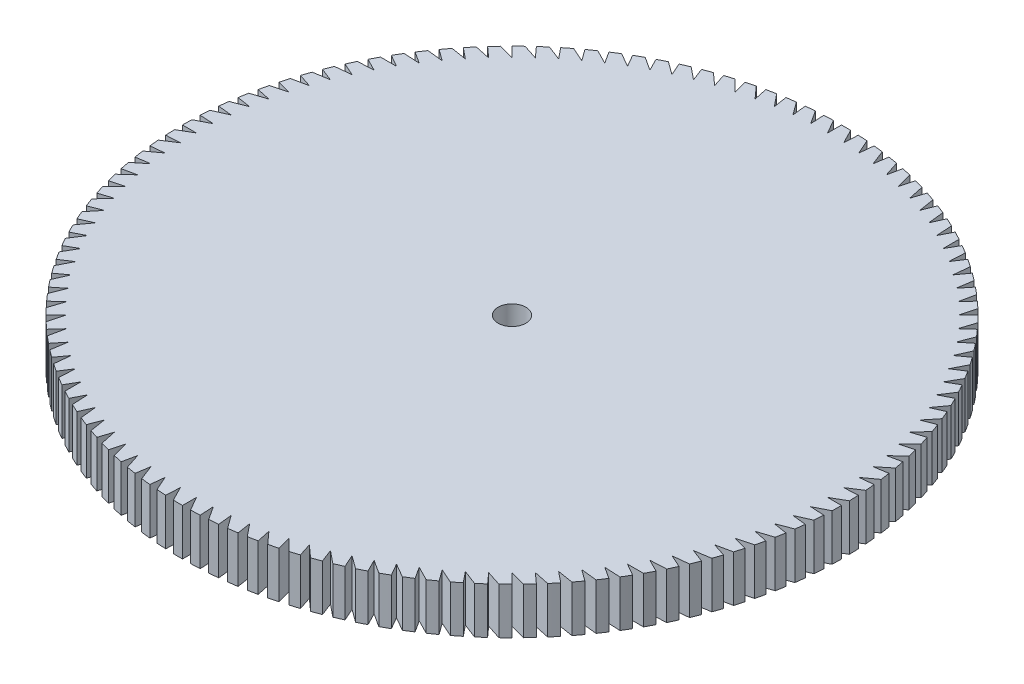
from build123d import *

# Parameters (mm, degrees)
SKETCH_1_R          = 71
EXTRUDE_1_DEPTH     = 10
SKETCH_2_R          = 3
CUT_EXTRUDE_1_DEPTH = 10
CUT_EXTRUDE_2_DEPTH = 101.905896755


with BuildPart() as part:
    # 草图1 → 凸台-拉伸1 (new body)
    with BuildSketch(Plane(origin=(0, 0, 0), x_dir=(1, 0, 0), z_dir=(0, 1, 0))):
        with Locations(Location((0, 0, 0), (0, 0, 270))):
            Circle(SKETCH_1_R)
    extrude(amount=EXTRUDE_1_DEPTH)

    # 草图2 → 切除-拉伸1 (cut)
    with BuildSketch(Plane(origin=(0, 10, 0), x_dir=(1, 0, 0), z_dir=(0, 1, 0))):
        with Locations(Location((0, 0, 0), (0, 0, 270))):
            Circle(SKETCH_2_R)
    extrude(amount=-CUT_EXTRUDE_1_DEPTH, mode=Mode.SUBTRACT)

    # 草图3 → 切除-拉伸2 (cut, through all)
    with BuildSketch(Plane(origin=(0, 10, 0), x_dir=(1, 0, 0), z_dir=(0, 1, 0))):
        with BuildLine():
            Line((0, -71), (0, -68))
            Line((0, -68), (1.720020356, -70.979162646))
            ThreePointArc((1.720020356, -70.979162646), (0.860073285, -70.99479047), (0, -71))
        make_face()
        with BuildLine():
            Line((-3.558845025, -67.906808363), (-1.997099223, -70.971907081))
            ThreePointArc((-1.997099223, -70.971907081), (-2.856685663, -70.942507335), (-3.715852893, -70.902696968))
            Line((-3.715852893, -70.902696968), (-3.558845025, -67.906808363))
        make_face()
        with BuildLine():
            Line((-7.107935502, -67.627488885), (-5.708744891, -70.770122451))
            ThreePointArc((-5.708744891, -70.770122451), (-6.565614635, -70.695775719), (-7.421520892, -70.611054571))
            Line((-7.421520892, -70.611054571), (-7.107935502, -67.627488885))
        make_face()
        with BuildLine():
            Line((-10.637543623, -67.16280716), (-9.404743287, -70.374361835))
            ThreePointArc((-9.404743287, -70.374361835), (-10.256547713, -70.255271895), (-11.106847018, -70.125872182))
            Line((-11.106847018, -70.125872182), (-10.637543623, -67.16280716))
        make_face()
        with BuildLine():
            Line((-14.137994976, -66.51403685), (-13.074963934, -69.785709985))
            ThreePointArc((-13.074963934, -69.785709985), (-13.919368306, -69.622203254), (-14.761730048, -69.448479652))
            Line((-14.761730048, -69.448479652), (-14.137994976, -66.51403685))
        make_face()
        with BuildLine():
            Line((-17.599695067, -65.682956188), (-16.709347015, -69.005780355))
            ThreePointArc((-16.709347015, -69.005780355), (-17.544036879, -68.798304994), (-18.376152202, -68.580733667))
            Line((-18.376152202, -68.580733667), (-17.599695067, -65.682956188))
        make_face()
        with BuildLine():
            Line((-21.013155617, -64.671843108), (-20.297930937, -68.036710677))
            ThreePointArc((-20.297930937, -68.036710677), (-21.120618466, -67.785835361), (-21.940206601, -67.525012657))
            Line((-21.940206601, -67.525012657), (-21.013155617, -64.671843108))
        make_face()
        with BuildLine():
            Line((-24.369020569, -63.483469002), (-23.830879641, -66.881157104))
            ThreePointArc((-23.830879641, -66.881157104), (-24.639309905, -66.587569466), (-25.444124418, -66.284210281))
            Line((-25.444124418, -66.284210281), (-24.369020569, -63.483469002))
        make_face()
        with BuildLine():
            Line((-27.658091729, -62.12109112), (-27.29850956, -65.542286928))
            ThreePointArc((-27.29850956, -65.542286928), (-28.090466709, -65.206791671), (-28.878301658, -64.861727493))
            Line((-28.878301658, -64.861727493), (-27.658091729, -62.12109112))
        make_face()
        with BuildLine():
            Line((-30.871353982, -60.588443645), (-30.691316162, -64.0237699))
            ThreePointArc((-30.691316162, -64.0237699), (-31.464629497, -63.647286593), (-32.233325482, -63.261463217))
            Line((-32.233325482, -63.261463217), (-30.871353982, -60.588443645))
        make_face()
        with BuildLine():
            Line((-34, -58.889727457), (-34, -62.329768169))
            ThreePointArc((-34, -62.329768169), (-34.752549922, -61.913328726), (-35.5, -61.487803669))
            Line((-35.5, -61.487803669), (-34, -58.889727457))
        make_face()
        with BuildLine():
            Line((-37.035454381, -57.02959862), (-37.215492201, -60.464924876))
            ThreePointArc((-37.215492201, -60.464924876), (-37.945216023, -60.009670729), (-38.669371486, -59.545610324))
            Line((-38.669371486, -59.545610324), (-37.035454381, -57.02959862))
        make_face()
        with BuildLine():
            Line((-39.969397156, -55.013155617), (-40.328979325, -58.434351426))
            ThreePointArc((-40.328979325, -58.434351426), (-41.033876924, -57.941530395), (-41.732752913, -57.440206601))
            Line((-41.732752913, -57.440206601), (-39.969397156, -55.013155617))
        make_face()
        with BuildLine():
            Line((-42.793786591, -52.845925379), (-43.33192752, -56.243613481))
            ThreePointArc((-43.33192752, -56.243613481), (-44.010066822, -55.714576354), (-44.681747765, -55.177363263))
            Line((-44.681747765, -55.177363263), (-42.793786591, -52.845925379))
        make_face()
        with BuildLine():
            Line((-45.500881232, -50.533848132), (-46.216105913, -53.898715701))
            ThreePointArc((-46.216105913, -53.898715701), (-46.865628185, -53.334912532), (-47.508273051, -52.763282609))
            Line((-47.508273051, -52.763282609), (-45.500881232, -50.533848132))
        make_face()
        with BuildLine():
            Line((-48.083261121, -48.083261121), (-48.973609173, -51.406085288))
            ThreePointArc((-48.973609173, -51.406085288), (-49.592734119, -50.809061422), (-50.204581464, -50.204581464))
            Line((-50.204581464, -50.204581464), (-48.083261121, -48.083261121))
        make_face()
        with BuildLine():
            Line((-50.533848132, -45.500881232), (-51.596879174, -48.772554368))
            ThreePointArc((-51.596879174, -48.772554368), (-52.183909816, -48.143946207), (-52.763282609, -47.508273051))
            Line((-52.763282609, -47.508273051), (-50.533848132, -45.500881232))
        make_face()
        with BuildLine():
            Line((-52.845925379, -42.793786591), (-54.078725715, -46.005341266))
            ThreePointArc((-54.078725715, -46.005341266), (-54.632053043, -45.346871781), (-55.177363263, -44.681747765))
            Line((-55.177363263, -44.681747765), (-52.845925379, -42.793786591))
        make_face()
        with BuildLine():
            Line((-55.013155617, -39.969397156), (-56.412346229, -43.112030722))
            ThreePointArc((-56.412346229, -43.112030722), (-56.93045361, -42.425504732), (-57.440206601, -41.732752913))
            Line((-57.440206601, -41.732752913), (-55.013155617, -39.969397156))
        make_face()
        with BuildLine():
            Line((-57.02959862, -37.035454381), (-58.591344422, -40.100553099))
            ThreePointArc((-58.591344422, -40.100553099), (-59.072811761, -39.387852323), (-59.545610324, -38.669371486))
            Line((-59.545610324, -38.669371486), (-57.02959862, -37.035454381))
        make_face()
        with BuildLine():
            Line((-58.889727457, -34), (-60.609747813, -36.979162646))
            ThreePointArc((-60.609747813, -36.979162646), (-61.053255441, -36.242240549), (-61.487803669, -35.5))
            Line((-61.487803669, -35.5), (-58.889727457, -34))
        make_face()
        with BuildLine():
            Line((-60.588443645, -30.871353982), (-62.462024098, -33.75641488))
            ThreePointArc((-62.462024098, -33.75641488), (-62.866356392, -32.997291312), (-63.261463217, -32.233325482))
            Line((-63.261463217, -32.233325482), (-60.588443645, -30.871353982))
        make_face()
        with BuildLine():
            Line((-62.12109112, -27.658091729), (-64.143096317, -30.441143126))
            ThreePointArc((-64.143096317, -30.441143126), (-64.50714503, -29.661898794), (-64.861727493, -28.878301658))
            Line((-64.861727493, -28.878301658), (-62.12109112, -27.658091729))
        make_face()
        with BuildLine():
            Line((-63.483469002, -24.369020569), (-65.648356768, -27.042434315))
            ThreePointArc((-65.648356768, -27.042434315), (-65.971124067, -26.245205073), (-66.284210281, -25.444124418))
            Line((-66.284210281, -25.444124418), (-63.483469002, -24.369020569))
        make_face()
        with BuildLine():
            Line((-64.671843108, -21.013155617), (-66.973679635, -23.569604072))
            ThreePointArc((-66.973679635, -23.569604072), (-67.254280839, -22.756575069), (-67.525012657, -21.940206601))
            Line((-67.525012657, -21.940206601), (-64.671843108, -21.013155617))
        make_face()
        with BuildLine():
            Line((-65.682956188, -17.599695067), (-68.115432302, -20.032171182))
            ThreePointArc((-68.115432302, -20.032171182), (-68.353098301, -19.205570875), (-68.580733667, -18.376152202))
            Line((-68.580733667, -18.376152202), (-65.682956188, -17.599695067))
        make_face()
        with BuildLine():
            Line((-66.51403685, -14.137994976), (-69.070485304, -16.439831503))
            ThreePointArc((-69.070485304, -16.439831503), (-69.264564672, -15.601925546), (-69.448479652, -14.761730048))
            Line((-69.448479652, -14.761730048), (-66.51403685, -14.137994976))
        make_face()
        with BuildLine():
            Line((-67.16280716, -10.637543623), (-69.836220907, -12.802431389))
            ThreePointArc((-69.836220907, -12.802431389), (-69.986181686, -11.955516423), (-70.125872182, -11.106847018))
            Line((-70.125872182, -11.106847018), (-67.16280716, -10.637543623))
        make_face()
        with BuildLine():
            Line((-67.627488885, -7.107935502), (-70.410540282, -9.1299407))
            ThreePointArc((-70.410540282, -9.1299407), (-70.515971441, -8.276338061), (-70.611054571, -7.421520892))
            Line((-70.611054571, -7.421520892), (-67.627488885, -7.107935502))
        make_face()
        with BuildLine():
            Line((-67.906808363, -3.558845025), (-70.791869261, -5.432425478))
            ThreePointArc((-70.791869261, -5.432425478), (-70.85248182, -4.574474832), (-70.902696968, -3.715852893))
            Line((-70.902696968, -3.715852893), (-67.906808363, -3.558845025))
        make_face()
        with BuildLine():
            Line((-68, 0), (-70.979162646, -1.720020356))
            ThreePointArc((-70.979162646, -1.720020356), (-70.99479047, -0.860073285), (-71, 0))
            Line((-71, 0), (-68, 0))
        make_face()
        with BuildLine():
            Line((-67.906808363, 3.558845025), (-70.971907081, 1.997099223))
            ThreePointArc((-70.971907081, 1.997099223), (-70.942507335, 2.856685663), (-70.902696968, 3.715852893))
            Line((-70.902696968, 3.715852893), (-67.906808363, 3.558845025))
        make_face()
        with BuildLine():
            Line((-67.627488885, 7.107935502), (-70.770122451, 5.708744891))
            ThreePointArc((-70.770122451, 5.708744891), (-70.695775719, 6.565614635), (-70.611054571, 7.421520892))
            Line((-70.611054571, 7.421520892), (-67.627488885, 7.107935502))
        make_face()
        with BuildLine():
            Line((-67.16280716, 10.637543623), (-70.374361835, 9.404743287))
            ThreePointArc((-70.374361835, 9.404743287), (-70.255271895, 10.256547713), (-70.125872182, 11.106847018))
            Line((-70.125872182, 11.106847018), (-67.16280716, 10.637543623))
        make_face()
        with BuildLine():
            Line((-66.51403685, 14.137994976), (-69.785709985, 13.074963934))
            ThreePointArc((-69.785709985, 13.074963934), (-69.622203254, 13.919368306), (-69.448479652, 14.761730048))
            Line((-69.448479652, 14.761730048), (-66.51403685, 14.137994976))
        make_face()
        with BuildLine():
            Line((-65.682956188, 17.599695067), (-69.005780355, 16.709347015))
            ThreePointArc((-69.005780355, 16.709347015), (-68.798304994, 17.544036879), (-68.580733667, 18.376152202))
            Line((-68.580733667, 18.376152202), (-65.682956188, 17.599695067))
        make_face()
        with BuildLine():
            Line((-64.671843108, 21.013155617), (-68.036710677, 20.297930937))
            ThreePointArc((-68.036710677, 20.297930937), (-67.785835361, 21.120618466), (-67.525012657, 21.940206601))
            Line((-67.525012657, 21.940206601), (-64.671843108, 21.013155617))
        make_face()
        with BuildLine():
            Line((-63.483469002, 24.369020569), (-66.881157104, 23.830879641))
            ThreePointArc((-66.881157104, 23.830879641), (-66.587569466, 24.639309905), (-66.284210281, 25.444124418))
            Line((-66.284210281, 25.444124418), (-63.483469002, 24.369020569))
        make_face()
        with BuildLine():
            Line((-62.12109112, 27.658091729), (-65.542286928, 27.29850956))
            ThreePointArc((-65.542286928, 27.29850956), (-65.206791671, 28.090466709), (-64.861727493, 28.878301658))
            Line((-64.861727493, 28.878301658), (-62.12109112, 27.658091729))
        make_face()
        with BuildLine():
            Line((-60.588443645, 30.871353982), (-64.0237699, 30.691316162))
            ThreePointArc((-64.0237699, 30.691316162), (-63.647286593, 31.464629497), (-63.261463217, 32.233325482))
            Line((-63.261463217, 32.233325482), (-60.588443645, 30.871353982))
        make_face()
        with BuildLine():
            Line((-58.889727457, 34), (-62.329768169, 34))
            ThreePointArc((-62.329768169, 34), (-61.913328726, 34.752549922), (-61.487803669, 35.5))
            Line((-61.487803669, 35.5), (-58.889727457, 34))
        make_face()
        with BuildLine():
            Line((-57.02959862, 37.035454381), (-60.464924876, 37.215492201))
            ThreePointArc((-60.464924876, 37.215492201), (-60.009670729, 37.945216023), (-59.545610324, 38.669371486))
            Line((-59.545610324, 38.669371486), (-57.02959862, 37.035454381))
        make_face()
        with BuildLine():
            Line((-55.013155617, 39.969397156), (-58.434351426, 40.328979325))
            ThreePointArc((-58.434351426, 40.328979325), (-57.941530395, 41.033876924), (-57.440206601, 41.732752913))
            Line((-57.440206601, 41.732752913), (-55.013155617, 39.969397156))
        make_face()
        with BuildLine():
            Line((-52.845925379, 42.793786591), (-56.243613481, 43.33192752))
            ThreePointArc((-56.243613481, 43.33192752), (-55.714576354, 44.010066822), (-55.177363263, 44.681747765))
            Line((-55.177363263, 44.681747765), (-52.845925379, 42.793786591))
        make_face()
        with BuildLine():
            Line((-50.533848132, 45.500881232), (-53.898715701, 46.216105913))
            ThreePointArc((-53.898715701, 46.216105913), (-53.334912532, 46.865628185), (-52.763282609, 47.508273051))
            Line((-52.763282609, 47.508273051), (-50.533848132, 45.500881232))
        make_face()
        with BuildLine():
            Line((-48.083261121, 48.083261121), (-51.406085288, 48.973609173))
            ThreePointArc((-51.406085288, 48.973609173), (-50.809061422, 49.592734119), (-50.204581464, 50.204581464))
            Line((-50.204581464, 50.204581464), (-48.083261121, 48.083261121))
        make_face()
        with BuildLine():
            Line((-45.500881232, 50.533848132), (-48.772554368, 51.596879174))
            ThreePointArc((-48.772554368, 51.596879174), (-48.143946207, 52.183909816), (-47.508273051, 52.763282609))
            Line((-47.508273051, 52.763282609), (-45.500881232, 50.533848132))
        make_face()
        with BuildLine():
            Line((-42.793786591, 52.845925379), (-46.005341266, 54.078725715))
            ThreePointArc((-46.005341266, 54.078725715), (-45.346871781, 54.632053043), (-44.681747765, 55.177363263))
            Line((-44.681747765, 55.177363263), (-42.793786591, 52.845925379))
        make_face()
        with BuildLine():
            Line((-39.969397156, 55.013155617), (-43.112030722, 56.412346229))
            ThreePointArc((-43.112030722, 56.412346229), (-42.425504732, 56.93045361), (-41.732752913, 57.440206601))
            Line((-41.732752913, 57.440206601), (-39.969397156, 55.013155617))
        make_face()
        with BuildLine():
            Line((-37.035454381, 57.02959862), (-40.100553099, 58.591344422))
            ThreePointArc((-40.100553099, 58.591344422), (-39.387852323, 59.072811761), (-38.669371486, 59.545610324))
            Line((-38.669371486, 59.545610324), (-37.035454381, 57.02959862))
        make_face()
        with BuildLine():
            Line((-34, 58.889727457), (-36.979162646, 60.609747813))
            ThreePointArc((-36.979162646, 60.609747813), (-36.242240549, 61.053255441), (-35.5, 61.487803669))
            Line((-35.5, 61.487803669), (-34, 58.889727457))
        make_face()
        with BuildLine():
            Line((-30.871353982, 60.588443645), (-33.75641488, 62.462024098))
            ThreePointArc((-33.75641488, 62.462024098), (-32.997291312, 62.866356392), (-32.233325482, 63.261463217))
            Line((-32.233325482, 63.261463217), (-30.871353982, 60.588443645))
        make_face()
        with BuildLine():
            Line((-27.658091729, 62.12109112), (-30.441143126, 64.143096317))
            ThreePointArc((-30.441143126, 64.143096317), (-29.661898794, 64.50714503), (-28.878301658, 64.861727493))
            Line((-28.878301658, 64.861727493), (-27.658091729, 62.12109112))
        make_face()
        with BuildLine():
            Line((-24.369020569, 63.483469002), (-27.042434315, 65.648356768))
            ThreePointArc((-27.042434315, 65.648356768), (-26.245205073, 65.971124067), (-25.444124418, 66.284210281))
            Line((-25.444124418, 66.284210281), (-24.369020569, 63.483469002))
        make_face()
        with BuildLine():
            Line((-21.013155617, 64.671843108), (-23.569604072, 66.973679635))
            ThreePointArc((-23.569604072, 66.973679635), (-22.756575069, 67.254280839), (-21.940206601, 67.525012657))
            Line((-21.940206601, 67.525012657), (-21.013155617, 64.671843108))
        make_face()
        with BuildLine():
            Line((-17.599695067, 65.682956188), (-20.032171182, 68.115432302))
            ThreePointArc((-20.032171182, 68.115432302), (-19.205570875, 68.353098301), (-18.376152202, 68.580733667))
            Line((-18.376152202, 68.580733667), (-17.599695067, 65.682956188))
        make_face()
        with BuildLine():
            Line((-14.137994976, 66.51403685), (-16.439831503, 69.070485304))
            ThreePointArc((-16.439831503, 69.070485304), (-15.601925546, 69.264564672), (-14.761730048, 69.448479652))
            Line((-14.761730048, 69.448479652), (-14.137994976, 66.51403685))
        make_face()
        with BuildLine():
            Line((-10.637543623, 67.16280716), (-12.802431389, 69.836220907))
            ThreePointArc((-12.802431389, 69.836220907), (-11.955516423, 69.986181686), (-11.106847018, 70.125872182))
            Line((-11.106847018, 70.125872182), (-10.637543623, 67.16280716))
        make_face()
        with BuildLine():
            Line((-7.107935502, 67.627488885), (-9.1299407, 70.410540282))
            ThreePointArc((-9.1299407, 70.410540282), (-8.276338061, 70.515971441), (-7.421520892, 70.611054571))
            Line((-7.421520892, 70.611054571), (-7.107935502, 67.627488885))
        make_face()
        with BuildLine():
            Line((-3.558845025, 67.906808363), (-5.432425478, 70.791869261))
            ThreePointArc((-5.432425478, 70.791869261), (-4.574474832, 70.85248182), (-3.715852893, 70.902696968))
            Line((-3.715852893, 70.902696968), (-3.558845025, 67.906808363))
        make_face()
        with BuildLine():
            Line((0, 68), (-1.720020356, 70.979162646))
            ThreePointArc((-1.720020356, 70.979162646), (-0.860073285, 70.99479047), (0, 71))
            Line((0, 71), (0, 68))
        make_face()
        with BuildLine():
            Line((3.558845025, 67.906808363), (1.997099223, 70.971907081))
            ThreePointArc((1.997099223, 70.971907081), (2.856685663, 70.942507335), (3.715852893, 70.902696968))
            Line((3.715852893, 70.902696968), (3.558845025, 67.906808363))
        make_face()
        with BuildLine():
            Line((7.107935502, 67.627488885), (5.708744891, 70.770122451))
            ThreePointArc((5.708744891, 70.770122451), (6.565614635, 70.695775719), (7.421520892, 70.611054571))
            Line((7.421520892, 70.611054571), (7.107935502, 67.627488885))
        make_face()
        with BuildLine():
            Line((10.637543623, 67.16280716), (9.404743287, 70.374361835))
            ThreePointArc((9.404743287, 70.374361835), (10.256547713, 70.255271895), (11.106847018, 70.125872182))
            Line((11.106847018, 70.125872182), (10.637543623, 67.16280716))
        make_face()
        with BuildLine():
            Line((14.137994976, 66.51403685), (13.074963934, 69.785709985))
            ThreePointArc((13.074963934, 69.785709985), (13.919368306, 69.622203254), (14.761730048, 69.448479652))
            Line((14.761730048, 69.448479652), (14.137994976, 66.51403685))
        make_face()
        with BuildLine():
            Line((17.599695067, 65.682956188), (16.709347015, 69.005780355))
            ThreePointArc((16.709347015, 69.005780355), (17.544036879, 68.798304994), (18.376152202, 68.580733667))
            Line((18.376152202, 68.580733667), (17.599695067, 65.682956188))
        make_face()
        with BuildLine():
            Line((21.013155617, 64.671843108), (20.297930937, 68.036710677))
            ThreePointArc((20.297930937, 68.036710677), (21.120618466, 67.785835361), (21.940206601, 67.525012657))
            Line((21.940206601, 67.525012657), (21.013155617, 64.671843108))
        make_face()
        with BuildLine():
            Line((24.369020569, 63.483469002), (23.830879641, 66.881157104))
            ThreePointArc((23.830879641, 66.881157104), (24.639309905, 66.587569466), (25.444124418, 66.284210281))
            Line((25.444124418, 66.284210281), (24.369020569, 63.483469002))
        make_face()
        with BuildLine():
            Line((27.658091729, 62.12109112), (27.29850956, 65.542286928))
            ThreePointArc((27.29850956, 65.542286928), (28.090466709, 65.206791671), (28.878301658, 64.861727493))
            Line((28.878301658, 64.861727493), (27.658091729, 62.12109112))
        make_face()
        with BuildLine():
            Line((30.871353982, 60.588443645), (30.691316162, 64.0237699))
            ThreePointArc((30.691316162, 64.0237699), (31.464629497, 63.647286593), (32.233325482, 63.261463217))
            Line((32.233325482, 63.261463217), (30.871353982, 60.588443645))
        make_face()
        with BuildLine():
            Line((34, 58.889727457), (34, 62.329768169))
            ThreePointArc((34, 62.329768169), (34.752549922, 61.913328726), (35.5, 61.487803669))
            Line((35.5, 61.487803669), (34, 58.889727457))
        make_face()
        with BuildLine():
            Line((37.035454381, 57.02959862), (37.215492201, 60.464924876))
            ThreePointArc((37.215492201, 60.464924876), (37.945216023, 60.009670729), (38.669371486, 59.545610324))
            Line((38.669371486, 59.545610324), (37.035454381, 57.02959862))
        make_face()
        with BuildLine():
            Line((39.969397156, 55.013155617), (40.328979325, 58.434351426))
            ThreePointArc((40.328979325, 58.434351426), (41.033876924, 57.941530395), (41.732752913, 57.440206601))
            Line((41.732752913, 57.440206601), (39.969397156, 55.013155617))
        make_face()
        with BuildLine():
            Line((42.793786591, 52.845925379), (43.33192752, 56.243613481))
            ThreePointArc((43.33192752, 56.243613481), (44.010066822, 55.714576354), (44.681747765, 55.177363263))
            Line((44.681747765, 55.177363263), (42.793786591, 52.845925379))
        make_face()
        with BuildLine():
            Line((45.500881232, 50.533848132), (46.216105913, 53.898715701))
            ThreePointArc((46.216105913, 53.898715701), (46.865628185, 53.334912532), (47.508273051, 52.763282609))
            Line((47.508273051, 52.763282609), (45.500881232, 50.533848132))
        make_face()
        with BuildLine():
            Line((48.083261121, 48.083261121), (48.973609173, 51.406085288))
            ThreePointArc((48.973609173, 51.406085288), (49.592734119, 50.809061422), (50.204581464, 50.204581464))
            Line((50.204581464, 50.204581464), (48.083261121, 48.083261121))
        make_face()
        with BuildLine():
            Line((50.533848132, 45.500881232), (51.596879174, 48.772554368))
            ThreePointArc((51.596879174, 48.772554368), (52.183909816, 48.143946207), (52.763282609, 47.508273051))
            Line((52.763282609, 47.508273051), (50.533848132, 45.500881232))
        make_face()
        with BuildLine():
            Line((52.845925379, 42.793786591), (54.078725715, 46.005341266))
            ThreePointArc((54.078725715, 46.005341266), (54.632053043, 45.346871781), (55.177363263, 44.681747765))
            Line((55.177363263, 44.681747765), (52.845925379, 42.793786591))
        make_face()
        with BuildLine():
            Line((55.013155617, 39.969397156), (56.412346229, 43.112030722))
            ThreePointArc((56.412346229, 43.112030722), (56.93045361, 42.425504732), (57.440206601, 41.732752913))
            Line((57.440206601, 41.732752913), (55.013155617, 39.969397156))
        make_face()
        with BuildLine():
            Line((57.02959862, 37.035454381), (58.591344422, 40.100553099))
            ThreePointArc((58.591344422, 40.100553099), (59.072811761, 39.387852323), (59.545610324, 38.669371486))
            Line((59.545610324, 38.669371486), (57.02959862, 37.035454381))
        make_face()
        with BuildLine():
            Line((58.889727457, 34), (60.609747813, 36.979162646))
            ThreePointArc((60.609747813, 36.979162646), (61.053255441, 36.242240549), (61.487803669, 35.5))
            Line((61.487803669, 35.5), (58.889727457, 34))
        make_face()
        with BuildLine():
            Line((60.588443645, 30.871353982), (62.462024098, 33.75641488))
            ThreePointArc((62.462024098, 33.75641488), (62.866356392, 32.997291312), (63.261463217, 32.233325482))
            Line((63.261463217, 32.233325482), (60.588443645, 30.871353982))
        make_face()
        with BuildLine():
            Line((62.12109112, 27.658091729), (64.143096317, 30.441143126))
            ThreePointArc((64.143096317, 30.441143126), (64.50714503, 29.661898794), (64.861727493, 28.878301658))
            Line((64.861727493, 28.878301658), (62.12109112, 27.658091729))
        make_face()
        with BuildLine():
            Line((63.483469002, 24.369020569), (65.648356768, 27.042434315))
            ThreePointArc((65.648356768, 27.042434315), (65.971124067, 26.245205073), (66.284210281, 25.444124418))
            Line((66.284210281, 25.444124418), (63.483469002, 24.369020569))
        make_face()
        with BuildLine():
            Line((64.671843108, 21.013155617), (66.973679635, 23.569604072))
            ThreePointArc((66.973679635, 23.569604072), (67.254280839, 22.756575069), (67.525012657, 21.940206601))
            Line((67.525012657, 21.940206601), (64.671843108, 21.013155617))
        make_face()
        with BuildLine():
            Line((65.682956188, 17.599695067), (68.115432302, 20.032171182))
            ThreePointArc((68.115432302, 20.032171182), (68.353098301, 19.205570875), (68.580733667, 18.376152202))
            Line((68.580733667, 18.376152202), (65.682956188, 17.599695067))
        make_face()
        with BuildLine():
            Line((66.51403685, 14.137994976), (69.070485304, 16.439831503))
            ThreePointArc((69.070485304, 16.439831503), (69.264564672, 15.601925546), (69.448479652, 14.761730048))
            Line((69.448479652, 14.761730048), (66.51403685, 14.137994976))
        make_face()
        with BuildLine():
            Line((67.16280716, 10.637543623), (69.836220907, 12.802431389))
            ThreePointArc((69.836220907, 12.802431389), (69.986181686, 11.955516423), (70.125872182, 11.106847018))
            Line((70.125872182, 11.106847018), (67.16280716, 10.637543623))
        make_face()
        with BuildLine():
            Line((67.627488885, 7.107935502), (70.410540282, 9.1299407))
            ThreePointArc((70.410540282, 9.1299407), (70.515971441, 8.276338061), (70.611054571, 7.421520892))
            Line((70.611054571, 7.421520892), (67.627488885, 7.107935502))
        make_face()
        with BuildLine():
            Line((67.906808363, 3.558845025), (70.791869261, 5.432425478))
            ThreePointArc((70.791869261, 5.432425478), (70.85248182, 4.574474832), (70.902696968, 3.715852893))
            Line((70.902696968, 3.715852893), (67.906808363, 3.558845025))
        make_face()
        with BuildLine():
            Line((68, 0), (70.979162646, 1.720020356))
            ThreePointArc((70.979162646, 1.720020356), (70.99479047, 0.860073285), (71, 0))
            Line((71, 0), (68, 0))
        make_face()
        with BuildLine():
            Line((67.906808363, -3.558845025), (70.971907081, -1.997099223))
            ThreePointArc((70.971907081, -1.997099223), (70.942507335, -2.856685663), (70.902696968, -3.715852893))
            Line((70.902696968, -3.715852893), (67.906808363, -3.558845025))
        make_face()
        with BuildLine():
            Line((67.627488885, -7.107935502), (70.770122451, -5.708744891))
            ThreePointArc((70.770122451, -5.708744891), (70.695775719, -6.565614635), (70.611054571, -7.421520892))
            Line((70.611054571, -7.421520892), (67.627488885, -7.107935502))
        make_face()
        with BuildLine():
            Line((67.16280716, -10.637543623), (70.374361835, -9.404743287))
            ThreePointArc((70.374361835, -9.404743287), (70.255271895, -10.256547713), (70.125872182, -11.106847018))
            Line((70.125872182, -11.106847018), (67.16280716, -10.637543623))
        make_face()
        with BuildLine():
            Line((66.51403685, -14.137994976), (69.785709985, -13.074963934))
            ThreePointArc((69.785709985, -13.074963934), (69.622203254, -13.919368306), (69.448479652, -14.761730048))
            Line((69.448479652, -14.761730048), (66.51403685, -14.137994976))
        make_face()
        with BuildLine():
            Line((65.682956188, -17.599695067), (69.005780355, -16.709347015))
            ThreePointArc((69.005780355, -16.709347015), (68.798304994, -17.544036879), (68.580733667, -18.376152202))
            Line((68.580733667, -18.376152202), (65.682956188, -17.599695067))
        make_face()
        with BuildLine():
            Line((64.671843108, -21.013155617), (68.036710677, -20.297930937))
            ThreePointArc((68.036710677, -20.297930937), (67.785835361, -21.120618466), (67.525012657, -21.940206601))
            Line((67.525012657, -21.940206601), (64.671843108, -21.013155617))
        make_face()
        with BuildLine():
            Line((63.483469002, -24.369020569), (66.881157104, -23.830879641))
            ThreePointArc((66.881157104, -23.830879641), (66.587569466, -24.639309905), (66.284210281, -25.444124418))
            Line((66.284210281, -25.444124418), (63.483469002, -24.369020569))
        make_face()
        with BuildLine():
            Line((62.12109112, -27.658091729), (65.542286928, -27.29850956))
            ThreePointArc((65.542286928, -27.29850956), (65.206791671, -28.090466709), (64.861727493, -28.878301658))
            Line((64.861727493, -28.878301658), (62.12109112, -27.658091729))
        make_face()
        with BuildLine():
            Line((60.588443645, -30.871353982), (64.0237699, -30.691316162))
            ThreePointArc((64.0237699, -30.691316162), (63.647286593, -31.464629497), (63.261463217, -32.233325482))
            Line((63.261463217, -32.233325482), (60.588443645, -30.871353982))
        make_face()
        with BuildLine():
            Line((58.889727457, -34), (62.329768169, -34))
            ThreePointArc((62.329768169, -34), (61.913328726, -34.752549922), (61.487803669, -35.5))
            Line((61.487803669, -35.5), (58.889727457, -34))
        make_face()
        with BuildLine():
            Line((57.02959862, -37.035454381), (60.464924876, -37.215492201))
            ThreePointArc((60.464924876, -37.215492201), (60.009670729, -37.945216023), (59.545610324, -38.669371486))
            Line((59.545610324, -38.669371486), (57.02959862, -37.035454381))
        make_face()
        with BuildLine():
            Line((55.013155617, -39.969397156), (58.434351426, -40.328979325))
            ThreePointArc((58.434351426, -40.328979325), (57.941530395, -41.033876924), (57.440206601, -41.732752913))
            Line((57.440206601, -41.732752913), (55.013155617, -39.969397156))
        make_face()
        with BuildLine():
            Line((52.845925379, -42.793786591), (56.243613481, -43.33192752))
            ThreePointArc((56.243613481, -43.33192752), (55.714576354, -44.010066822), (55.177363263, -44.681747765))
            Line((55.177363263, -44.681747765), (52.845925379, -42.793786591))
        make_face()
        with BuildLine():
            Line((50.533848132, -45.500881232), (53.898715701, -46.216105913))
            ThreePointArc((53.898715701, -46.216105913), (53.334912532, -46.865628185), (52.763282609, -47.508273051))
            Line((52.763282609, -47.508273051), (50.533848132, -45.500881232))
        make_face()
        with BuildLine():
            Line((48.083261121, -48.083261121), (51.406085288, -48.973609173))
            ThreePointArc((51.406085288, -48.973609173), (50.809061422, -49.592734119), (50.204581464, -50.204581464))
            Line((50.204581464, -50.204581464), (48.083261121, -48.083261121))
        make_face()
        with BuildLine():
            Line((45.500881232, -50.533848132), (48.772554368, -51.596879174))
            ThreePointArc((48.772554368, -51.596879174), (48.143946207, -52.183909816), (47.508273051, -52.763282609))
            Line((47.508273051, -52.763282609), (45.500881232, -50.533848132))
        make_face()
        with BuildLine():
            Line((42.793786591, -52.845925379), (46.005341266, -54.078725715))
            ThreePointArc((46.005341266, -54.078725715), (45.346871781, -54.632053043), (44.681747765, -55.177363263))
            Line((44.681747765, -55.177363263), (42.793786591, -52.845925379))
        make_face()
        with BuildLine():
            Line((39.969397156, -55.013155617), (43.112030722, -56.412346229))
            ThreePointArc((43.112030722, -56.412346229), (42.425504732, -56.93045361), (41.732752913, -57.440206601))
            Line((41.732752913, -57.440206601), (39.969397156, -55.013155617))
        make_face()
        with BuildLine():
            Line((37.035454381, -57.02959862), (40.100553099, -58.591344422))
            ThreePointArc((40.100553099, -58.591344422), (39.387852323, -59.072811761), (38.669371486, -59.545610324))
            Line((38.669371486, -59.545610324), (37.035454381, -57.02959862))
        make_face()
        with BuildLine():
            Line((34, -58.889727457), (36.979162646, -60.609747813))
            ThreePointArc((36.979162646, -60.609747813), (36.242240549, -61.053255441), (35.5, -61.487803669))
            Line((35.5, -61.487803669), (34, -58.889727457))
        make_face()
        with BuildLine():
            Line((30.871353982, -60.588443645), (33.75641488, -62.462024098))
            ThreePointArc((33.75641488, -62.462024098), (32.997291312, -62.866356392), (32.233325482, -63.261463217))
            Line((32.233325482, -63.261463217), (30.871353982, -60.588443645))
        make_face()
        with BuildLine():
            Line((27.658091729, -62.12109112), (30.441143126, -64.143096317))
            ThreePointArc((30.441143126, -64.143096317), (29.661898794, -64.50714503), (28.878301658, -64.861727493))
            Line((28.878301658, -64.861727493), (27.658091729, -62.12109112))
        make_face()
        with BuildLine():
            Line((24.369020569, -63.483469002), (27.042434315, -65.648356768))
            ThreePointArc((27.042434315, -65.648356768), (26.245205073, -65.971124067), (25.444124418, -66.284210281))
            Line((25.444124418, -66.284210281), (24.369020569, -63.483469002))
        make_face()
        with BuildLine():
            Line((21.013155617, -64.671843108), (23.569604072, -66.973679635))
            ThreePointArc((23.569604072, -66.973679635), (22.756575069, -67.254280839), (21.940206601, -67.525012657))
            Line((21.940206601, -67.525012657), (21.013155617, -64.671843108))
        make_face()
        with BuildLine():
            Line((17.599695067, -65.682956188), (20.032171182, -68.115432302))
            ThreePointArc((20.032171182, -68.115432302), (19.205570875, -68.353098301), (18.376152202, -68.580733667))
            Line((18.376152202, -68.580733667), (17.599695067, -65.682956188))
        make_face()
        with BuildLine():
            Line((14.137994976, -66.51403685), (16.439831503, -69.070485304))
            ThreePointArc((16.439831503, -69.070485304), (15.601925546, -69.264564672), (14.761730048, -69.448479652))
            Line((14.761730048, -69.448479652), (14.137994976, -66.51403685))
        make_face()
        with BuildLine():
            Line((10.637543623, -67.16280716), (12.802431389, -69.836220907))
            ThreePointArc((12.802431389, -69.836220907), (11.955516423, -69.986181686), (11.106847018, -70.125872182))
            Line((11.106847018, -70.125872182), (10.637543623, -67.16280716))
        make_face()
        with BuildLine():
            Line((7.107935502, -67.627488885), (9.1299407, -70.410540282))
            ThreePointArc((9.1299407, -70.410540282), (8.276338061, -70.515971441), (7.421520892, -70.611054571))
            Line((7.421520892, -70.611054571), (7.107935502, -67.627488885))
        make_face()
        with BuildLine():
            Line((3.558845025, -67.906808363), (5.432425478, -70.791869261))
            ThreePointArc((5.432425478, -70.791869261), (4.574474832, -70.85248182), (3.715852893, -70.902696968))
            Line((3.715852893, -70.902696968), (3.558845025, -67.906808363))
        make_face()
    extrude(amount=-CUT_EXTRUDE_2_DEPTH, mode=Mode.SUBTRACT)


solid = part.part
